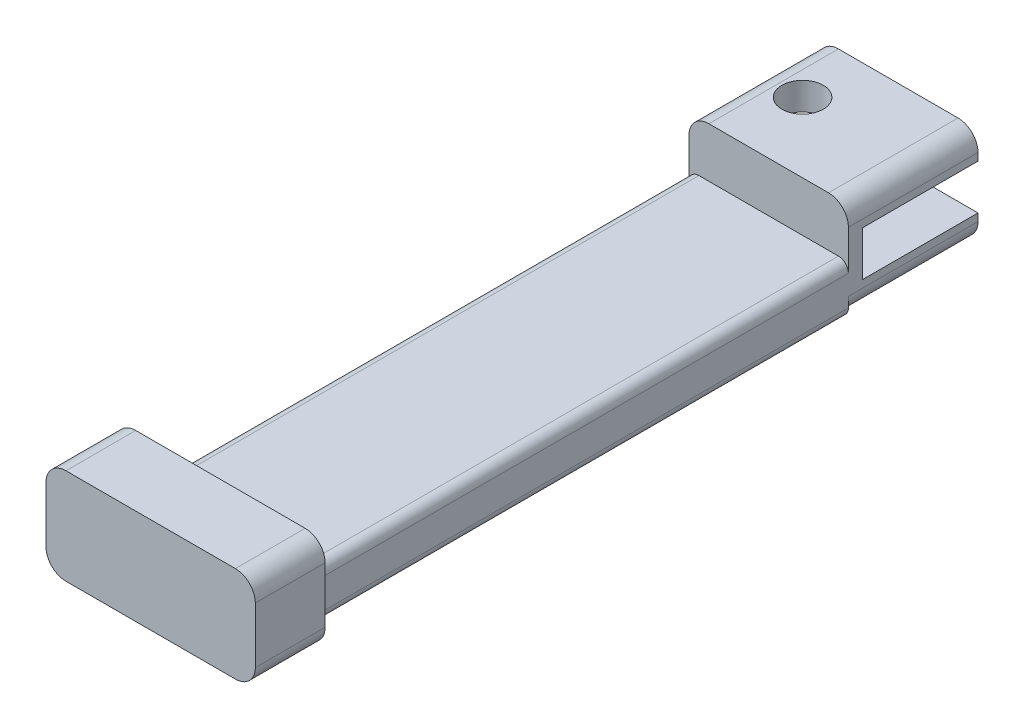
from build123d import *

# Parameters (mm, degrees)
F_01_START                                = 13
F_01_TPU_16_BY_5_GAUGE_DEPTH              = 55
F_02_CORD_END_BLOCK_DEPTH                 = 13
F_03_START                                = 68
F_03_CAPTURED_TAIL_BUTTON_DEPTH           = 7
F_04_START                                = -0.2
S04_OPEN_TWO_EAR_PIN_CLEVIS_W             = 18
S04_OPEN_TWO_EAR_PIN_CLEVIS_H             = 4.5
F_04_OPEN_TWO_EAR_PIN_CLEVIS_DEPTH        = 11.8
F_05_START                                = -5.2
S05_SHOULDER_PIN_THROUGH_BOTH_EARS_R      = 2.08
F_05_SHOULDER_PIN_THROUGH_BOTH_EARS_DEPTH = 10.4


with BuildPart() as part:
    # S01 - TPU 16 by 5 gauge → 01 - TPU 16 by 5 gauge (new body)
    with BuildSketch(Plane.XY.offset(F_01_START)):
        with BuildLine():
            Line((-7, -5), (7, -5))
            ThreePointArc((7, -5), (7.707106781, -4.707106781), (8, -4))
            Line((8, -4), (8, -1))
            ThreePointArc((8, -1), (7.707106781, -0.292893219), (7, 0))
            Line((7, 0), (-7, 0))
            ThreePointArc((-7, 0), (-7.707106781, -0.292893219), (-8, -1))
            Line((-8, -1), (-8, -4))
            ThreePointArc((-8, -4), (-7.707106781, -4.707106781), (-7, -5))
        make_face()
    extrude(amount=F_01_TPU_16_BY_5_GAUGE_DEPTH)

    # S02 - Cord end block → 02 - Cord end block (add)
    with BuildSketch(Plane.XY):
        with BuildLine():
            Line((-6, -5), (6, -5))
            ThreePointArc((6, -5), (7.414213562, -4.414213562), (8, -3))
            Line((8, -3), (8, 3))
            ThreePointArc((8, 3), (7.414213562, 4.414213562), (6, 5))
            Line((6, 5), (-6, 5))
            ThreePointArc((-6, 5), (-7.414213562, 4.414213562), (-8, 3))
            Line((-8, 3), (-8, -3))
            ThreePointArc((-8, -3), (-7.414213562, -4.414213562), (-6, -5))
        make_face()
    extrude(amount=F_02_CORD_END_BLOCK_DEPTH)

    # S03 - Captured tail button → 03 - Captured tail button (add)
    with BuildSketch(Plane.XY.offset(F_03_START)):
        with BuildLine():
            Line((-8.5, -5), (8.5, -5))
            ThreePointArc((8.5, -5), (9.914213562, -4.414213562), (10.5, -3))
            Line((10.5, -3), (10.5, 2.6))
            ThreePointArc((10.5, 2.6), (9.914213562, 4.014213562), (8.5, 4.6))
            Line((8.5, 4.6), (-8.5, 4.6))
            ThreePointArc((-8.5, 4.6), (-9.914213562, 4.014213562), (-10.5, 2.6))
            Line((-10.5, 2.6), (-10.5, -3))
            ThreePointArc((-10.5, -3), (-9.914213562, -4.414213562), (-8.5, -5))
        make_face()
    extrude(amount=F_03_CAPTURED_TAIL_BUTTON_DEPTH)

    # S04 - Open two-ear pin clevis → 04 - Open two-ear pin clevis (cut)
    with BuildSketch(Plane.XY.offset(F_04_START)):
        Rectangle(S04_OPEN_TWO_EAR_PIN_CLEVIS_W, S04_OPEN_TWO_EAR_PIN_CLEVIS_H)
    extrude(amount=F_04_OPEN_TWO_EAR_PIN_CLEVIS_DEPTH, mode=Mode.SUBTRACT)

    # S05 - Shoulder pin through both ears → 05 - Shoulder pin through both ears (cut)
    with BuildSketch(Plane(origin=(0, 0, 0), x_dir=(1, 0, 0), z_dir=(0, 1, 0)).offset(F_05_START)):
        with Locations(Location((-3.6, -6, 0), (0, 0, 90))):
            Circle(S05_SHOULDER_PIN_THROUGH_BOTH_EARS_R)
    extrude(amount=F_05_SHOULDER_PIN_THROUGH_BOTH_EARS_DEPTH, mode=Mode.SUBTRACT)


solid = part.part
